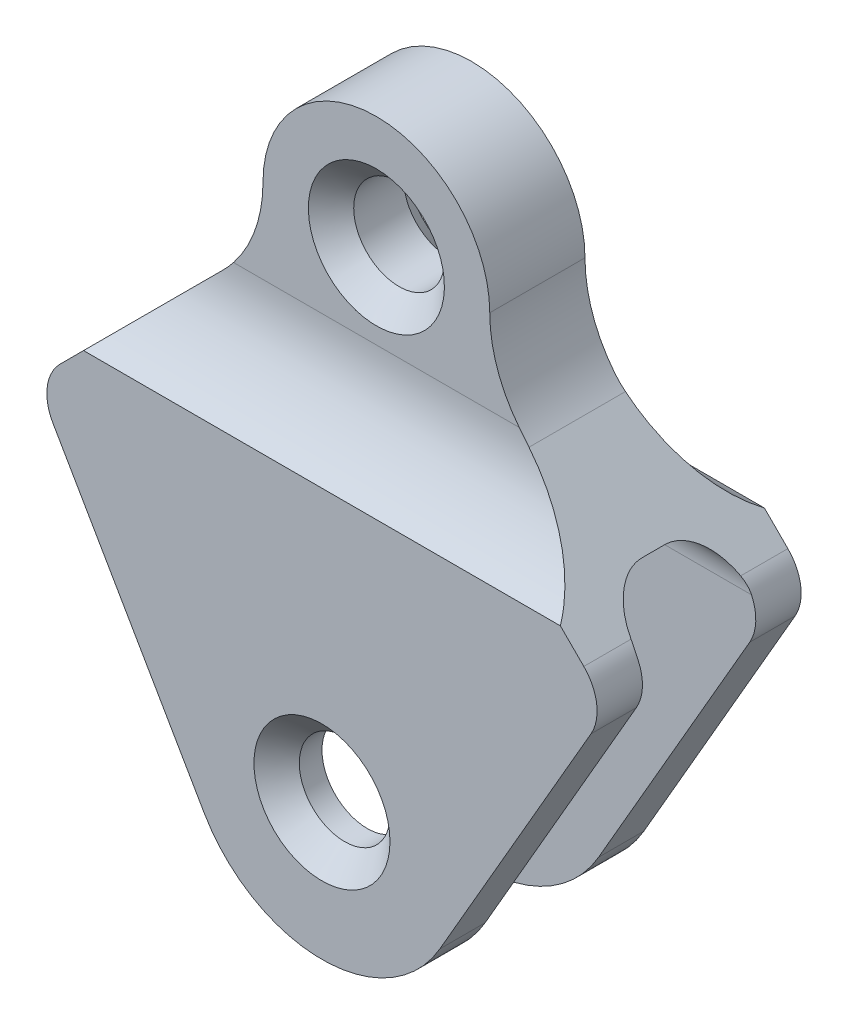
from build123d import *

# Parameters (mm, degrees)
SKETCH1_R               = 10
BOSS_EXTRUDE1_DEPTH     = 22.5
CUT_EXTRUDE1_DEPTH      = 141.755212167
CUT_EXTRUDE1_DEPTH_BACK = 141.755212167
CUT_EXTRUDE2_DEPTH      = 141.755212226
CHAMFER1_SIZE           = 5


with BuildPart() as part:
    # Sketch1 → Boss-Extrude1 (new, symmetric)
    with BuildSketch(Plane.XY):
        with BuildLine():
            ThreePointArc((-25.980762114, -15), (0, -30), (25.980762114, -15))
            Line((25.980762114, -15), (59.329684168, 42.762027375))
            ThreePointArc((59.329684168, 42.762027375), (60.583878744, 49.067289298), (57.740497942, 54.833095187))
            Line((57.740497942, 54.833095187), (33.786796564, 78.786796564))
            ThreePointArc((33.786796564, 78.786796564), (27.283614025, 88.519497029), (25, 100))
            ThreePointArc((25, 100), (0, 125), (-25, 100))
            ThreePointArc((-25, 100), (-27.283614025, 88.519497029), (-33.786796564, 78.786796564))
            Line((-33.786796564, 78.786796564), (-57.740497942, 54.833095187))
            ThreePointArc((-57.740497942, 54.833095187), (-60.583878744, 49.067289298), (-59.329684168, 42.762027375))
            Line((-59.329684168, 42.762027375), (-25.980762114, -15))
        make_face()
        with Locations(Location((0, 0, 0), (0, 0, 180))):
            Circle(SKETCH1_R, mode=Mode.SUBTRACT)
        with Locations(Location((0, 100, 0), (0, 0, 180))):
            Circle(SKETCH1_R, mode=Mode.SUBTRACT)
    extrude(amount=BOSS_EXTRUDE1_DEPTH, both=True)

    # Sketch2 → Cut-Extrude1 (cut, two sides: drawn at the far end of the back side and taken through both)
    with BuildSketch(Plane(origin=(0, 0, 0), x_dir=(0, 0, -1), z_dir=(1, 0, 0)).offset(-CUT_EXTRUDE1_DEPTH_BACK)):
        with BuildLine():
            Line((-2.5, 62), (2.5, 62))
            ThreePointArc((2.5, 62), (9.571067812, 59.071067812), (12.5, 52))
            Line((12.5, 52), (12.5, -30))
            Line((12.5, -30), (-12.5, -30))
            Line((-12.5, -30), (-12.5, 52))
            ThreePointArc((-12.5, 52), (-9.571067812, 59.071067812), (-2.5, 62))
        make_face()
    extrude(amount=CUT_EXTRUDE1_DEPTH + CUT_EXTRUDE1_DEPTH_BACK, mode=Mode.SUBTRACT)

    # Sketch3 → Cut-Extrude2 (cut, symmetric)
    with BuildSketch(Plane(origin=(0, 0, 0), x_dir=(0, 0, -1), z_dir=(1, 0, 0))):
        with BuildLine():
            Line((-10.5, 125), (-10.5, 81.354156504))
            ThreePointArc((-10.5, 81.354156504), (-13.705505282, 69.10670779), (-22.5, 60))
            Line((-22.5, 60), (-22.5, 125))
            Line((-22.5, 125), (-10.5, 125))
        make_face()
    cut_extrude2 = extrude(amount=CUT_EXTRUDE2_DEPTH, both=True, mode=Mode.SUBTRACT)

    # Mirror1: Cut-Extrude2 across plane
    add(cut_extrude2.mirror(Plane.XY), mode=Mode.SUBTRACT)

    # Chamfer1
    chamfer1_edges = [part.edges().sort_by_distance(p)[0] for p in [
        (10, 100, 10.5),
        (10, 100, -10.5),
        (10, 0, -22.5),
        (10, 0, 22.5),
    ]]
    chamfer(chamfer1_edges, length=CHAMFER1_SIZE)


solid = part.part
